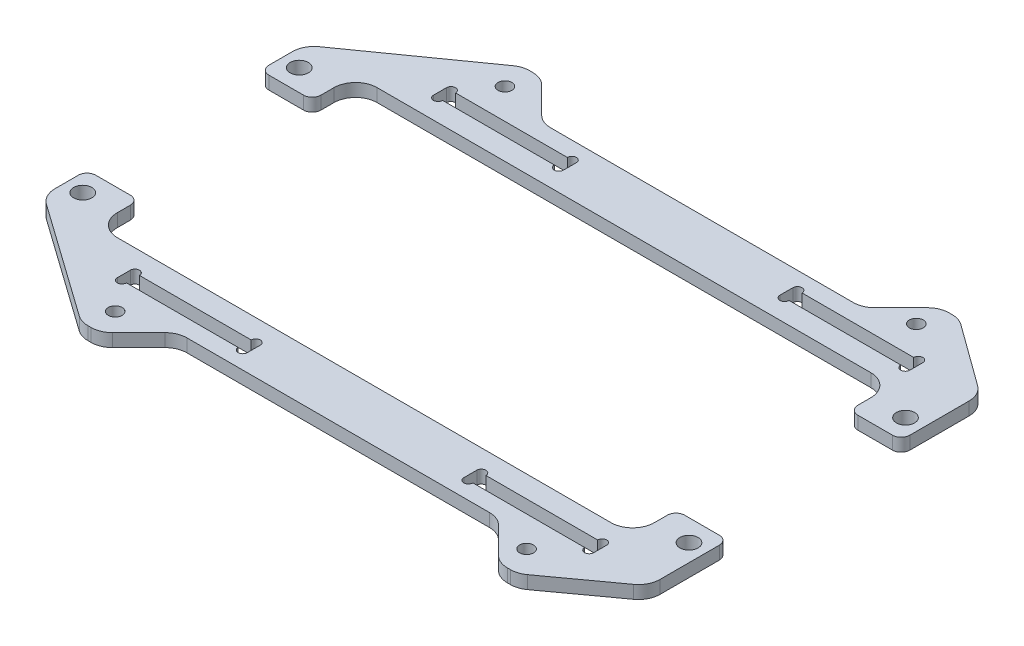
from build123d import *

# Parameters (mm, degrees)
SKETCH_1_W           = 160
SKETCH_1_H           = 120
EXTRUDE_1_DEPTH      = 3
SKETCH_2_R           = 1.6
CUT_EXTRUDE_1_DEPTH  = 3
CUT_EXTRUDE_2_DEPTH  = 3
SKETCH_14_W          = 12
SKETCH_14_H          = 80.138391148
CUT_EXTRUDE_13_DEPTH = 101.04498988
SKETCH_4_R           = 2.1
CUT_EXTRUDE_3_DEPTH  = 8
SKETCH_5_W           = 30
SKETCH_5_H           = 3
CUT_EXTRUDE_4_DEPTH  = 8
CUT_EXTRUDE_7_DEPTH  = 5
FILLET_2_R           = 5
SKETCH_11_R          = 1.05
CUT_EXTRUDE_10_DEPTH = 10
CUT_EXTRUDE_12_DEPTH = 10
CUT_EXTRUDE_14_DEPTH = 95.921019801
SKETCH_16_W          = 148
SKETCH_16_H          = 40
CUT_EXTRUDE_15_DEPTH = 95.921019801
FILLET_3_R           = 2
FILLET_4_R           = 2


with BuildPart() as part:
    # 草图1 → 凸台-拉伸1 (new body)
    with BuildSketch(Plane(origin=(0, 0, 0), x_dir=(1, 0, 0), z_dir=(0, 1, 0))):
        Rectangle(SKETCH_1_W, SKETCH_1_H)
    extrude(amount=EXTRUDE_1_DEPTH)

    # 草图2 → 切除-拉伸1 (cut)
    with BuildSketch(Plane(origin=(0, 3, 0), x_dir=(1, 0, 0), z_dir=(0, 1, 0))):
        with Locations(Location((-48.5, 45, 0), (0, 0, 270))):
            Circle(SKETCH_2_R)
        with Locations(Location((-48.5, -45, 0), (0, 0, 270))):
            Circle(SKETCH_2_R)
        with Locations(Location((46.5, -45, 0), (0, 0, 270))):
            Circle(SKETCH_2_R)
        with Locations(Location((46.5, 45, 0), (0, 0, 270))):
            Circle(SKETCH_2_R)
    extrude(amount=-CUT_EXTRUDE_1_DEPTH, mode=Mode.SUBTRACT)

    # 草图3 → 切除-拉伸2 (cut)
    with BuildSketch(Plane(origin=(0, 3, 0), x_dir=(1, 0, 0), z_dir=(0, 1, 0))):
        Polygon((-80, 60), (-80, 30), (-44.247392222, 60), align=None)
        Polygon((44.247392222, 60), (80, 30), (80, 60), align=None)
        Polygon((80, -60), (80, -30), (44.247392222, -60), align=None)
        Polygon((-44.247392222, -60), (-80, -30), (-80, -60), align=None)
    extrude(amount=-CUT_EXTRUDE_2_DEPTH, mode=Mode.SUBTRACT)

    # 草图14 → 切除-拉伸13 (cut, through all)
    with BuildSketch(Plane(origin=(0, 3, 0), x_dir=(1, 0, 0), z_dir=(0, 1, 0))):
        with Locations((74, 0)):
            Rectangle(SKETCH_14_W, SKETCH_14_H)
    extrude(amount=-CUT_EXTRUDE_13_DEPTH, mode=Mode.SUBTRACT)

    # 草图4 → 切除-拉伸3 (cut)
    with BuildSketch(Plane(origin=(0, 3, 0), x_dir=(1, 0, 0), z_dir=(0, 1, 0))):
        with Locations(Location((-76, 25, 0), (0, 0, 270))):
            Circle(SKETCH_4_R)
        with Locations(Location((-76, -25, 0), (0, 0, 270))):
            Circle(SKETCH_4_R)
        with Locations(Location((-76, 0, 0), (0, 0, 270))):
            Circle(SKETCH_4_R)
        with Locations(Location((64, 25, 0), (0, 0, 270))):
            Circle(SKETCH_4_R)
        with Locations(Location((64, -25, 0), (0, 0, 270))):
            Circle(SKETCH_4_R)
        with Locations(Location((64, 0, 0), (0, 0, 270))):
            Circle(SKETCH_4_R)
    extrude(amount=-CUT_EXTRUDE_3_DEPTH, mode=Mode.SUBTRACT)

    # 草图5 → 切除-拉伸4 (cut)
    with BuildSketch(Plane(origin=(0, 3, 0), x_dir=(1, 0, 0), z_dir=(0, 1, 0))):
        with Locations((-40, 36.5)):
            Rectangle(SKETCH_5_W, SKETCH_5_H)
        with Locations((40, 36.5)):
            Rectangle(SKETCH_5_W, SKETCH_5_H)
        with Locations((-40, -36.5)):
            Rectangle(SKETCH_5_W, SKETCH_5_H)
        with Locations((40, -36.5)):
            Rectangle(SKETCH_5_W, SKETCH_5_H)
    extrude(amount=-CUT_EXTRUDE_4_DEPTH, mode=Mode.SUBTRACT)

    # 草图7 → 切除-拉伸7 (cut)
    with BuildSketch(Plane(origin=(0, 3, 0), x_dir=(1, 0, 0), z_dir=(0, 1, 0))):
        Polygon((-80, -30), (-50.412878475, -51), (-46.014718626, -51), (-37.014718626, -42), (37.014718626, -42), (46.014718626, -51), (50.412878475, -51), (68, -38.224203086), (68, -40.069195574), (44.247392222, -60), (-44.247392222, -60), align=None)
        Polygon((68, 40.069195574), (68, 38.224203086), (50.412878475, 51), (46.014718626, 51), (37.014718626, 42), (-37.014718626, 42), (-46.014718626, 51), (-50.412878475, 51), (-80, 30), (-44.247392222, 60), (44.247392222, 60), align=None)
    extrude(amount=-CUT_EXTRUDE_7_DEPTH, mode=Mode.SUBTRACT)

    # 圆角2
    fillet_2_edges = [part.edges().sort_by_distance(p)[0] for p in [
        (68, 1.5, 38.224203086),
        (68, 1.5, -38.224203086),
        (50.412878475, 1.5, -51),
        (46.014718626, 1.5, -51),
        (37.014718626, 1.5, -42),
        (-37.014718626, 1.5, -42),
        (-46.014718626, 1.5, -51),
        (-50.412878475, 1.5, -51),
        (-50.412878475, 1.5, 51),
        (-46.014718626, 1.5, 51),
        (-37.014718626, 1.5, 42),
        (37.014718626, 1.5, 42),
        (46.014718626, 1.5, 51),
        (50.412878475, 1.5, 51),
        (-80, 1.5, 30),
        (-80, 1.5, -30),
    ]]
    fillet(fillet_2_edges, radius=FILLET_2_R)

    # 草图11 → 切除-拉伸10 (cut)
    with BuildSketch(Plane(origin=(0, 3, 0), x_dir=(1, 0, 0), z_dir=(0, 1, 0))):
        with Locations((-53.95, 38)):
            Circle(SKETCH_11_R)
        with Locations((-53.95, 35)):
            Circle(SKETCH_11_R)
        with Locations((-26.05, 35)):
            Circle(SKETCH_11_R)
        with Locations((-26.05, 38)):
            Circle(SKETCH_11_R)
        with Locations((26.05, 38)):
            Circle(SKETCH_11_R)
        with Locations((26.05, 35)):
            Circle(SKETCH_11_R)
        with Locations((53.95, 35)):
            Circle(SKETCH_11_R)
        with Locations((53.95, 38)):
            Circle(SKETCH_11_R)
        with Locations((53.95, -38)):
            Circle(SKETCH_11_R)
        with Locations((53.95, -35)):
            Circle(SKETCH_11_R)
        with Locations((26.05, -35)):
            Circle(SKETCH_11_R)
        with Locations((26.05, -38)):
            Circle(SKETCH_11_R)
        with Locations((-26.05, -38)):
            Circle(SKETCH_11_R)
        with Locations((-26.05, -35)):
            Circle(SKETCH_11_R)
        with Locations((-53.95, -35)):
            Circle(SKETCH_11_R)
        with Locations((-53.95, -38)):
            Circle(SKETCH_11_R)
    extrude(amount=-CUT_EXTRUDE_10_DEPTH, mode=Mode.SUBTRACT)

    # 草图13 → 切除-拉伸12 (cut)
    with BuildSketch(Plane(origin=(0, 3, 0), x_dir=(1, 0, 0), z_dir=(0, 1, 0))):
        Polygon((-8.660254038, 0), (-4.330127019, -7.5), (4.330127019, -7.5), (8.660254038, 0), (4.330127019, 7.5), (-4.330127019, 7.5), align=None)
    extrude(amount=-CUT_EXTRUDE_12_DEPTH, mode=Mode.SUBTRACT)

    # 草图15 → 切除-拉伸14 (cut, through all)
    with BuildSketch(Plane(origin=(0, 3, 0), x_dir=(1, 0, 0), z_dir=(0, 1, 0))):
        with BuildLine():
            Line((-63, 30), (51, 30))
            ThreePointArc((51, 30), (54.535533906, 28.535533906), (56, 25))
            Line((56, 25), (56, -25))
            ThreePointArc((56, -25), (54.535533906, -28.535533906), (51, -30))
            Line((51, -30), (-63, -30))
            ThreePointArc((-63, -30), (-66.535533906, -28.535533906), (-68, -25))
            Line((-68, -25), (-68, 25))
            ThreePointArc((-68, 25), (-66.535533906, 28.535533906), (-63, 30))
        make_face()
    extrude(amount=-CUT_EXTRUDE_14_DEPTH, mode=Mode.SUBTRACT)

    # 草图16 → 切除-拉伸15 (cut, through all)
    with BuildSketch(Plane(origin=(0, 3, 0), x_dir=(1, 0, 0), z_dir=(0, 1, 0))):
        with Locations((-6, 0)):
            Rectangle(SKETCH_16_W, SKETCH_16_H)
    extrude(amount=-CUT_EXTRUDE_15_DEPTH, mode=Mode.SUBTRACT)


with BuildPart() as cut_extrude_15_piece_1:
    # of the separate pieces the step leaves, piece 1, a body of its own (cut_extrude_15_pieces)
    add(part.part.solids().sort_by_distance((-80, 0, -27.417424305))[0])

    # 圆角3
    fillet_3_edges = [cut_extrude_15_piece_1.edges().sort_by_distance(p)[0] for p in [
        (68, 1.5, -20),
        (-80, 1.5, -20),
        (-68, 1.5, -20),
        (56, 1.5, -20),
    ]]
    fillet(fillet_3_edges, radius=FILLET_3_R)


with BuildPart() as cut_extrude_15_piece_2:
    # of the separate pieces the step leaves, piece 2, a body of its own (cut_extrude_15_pieces)
    add(part.part.solids().sort_by_distance((-68, 0, 20))[0])

    # 圆角4
    fillet_4_edges = [cut_extrude_15_piece_2.edges().sort_by_distance(p)[0] for p in [
        (56, 1.5, 20),
        (-68, 1.5, 20),
        (68, 1.5, 20),
        (-80, 1.5, 20),
    ]]
    fillet(fillet_4_edges, radius=FILLET_4_R)


solid = Compound([cut_extrude_15_piece_1.part, cut_extrude_15_piece_2.part])
